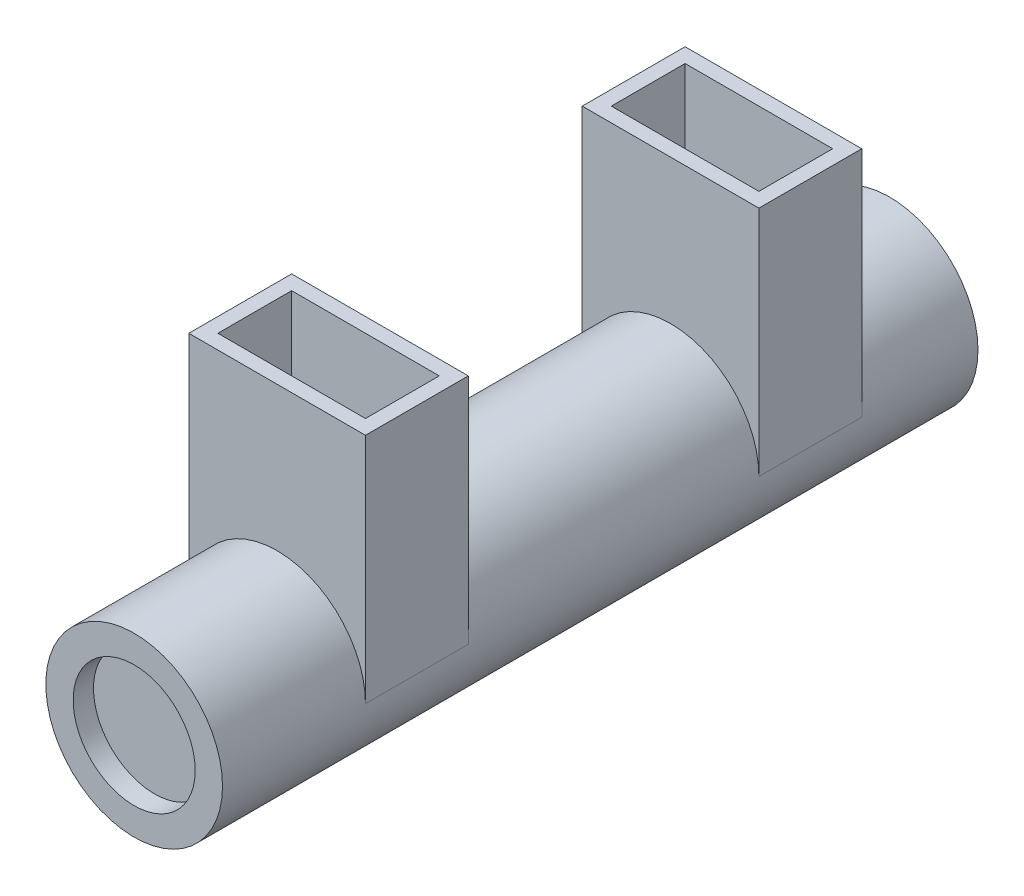
from build123d import *

# Parameters (mm, degrees)
SKETCH1_R           = 30.4
BOSS_EXTRUDE1_DEPTH = 260
SKETCH2_W           = 60.8
SKETCH2_H           = 35.4
BOSS_EXTRUDE2_DEPTH = 80
SKETCH3_W           = 50.8
SKETCH3_H           = 25.4
CUT_EXTRUDE1_DEPTH  = 80
CUT_EXTRUDE2_DEPTH  = 40
SKETCH5_R           = 21
CUT_EXTRUDE3_DEPTH  = 7


with BuildPart() as part:
    # Sketch1 → Boss-Extrude1 (new body)
    with BuildSketch(Plane.XY):
        Circle(SKETCH1_R)
    extrude(amount=BOSS_EXTRUDE1_DEPTH)

    # Sketch2 → Boss-Extrude2 (add)
    with BuildSketch(Plane(origin=(0, 0, 0), x_dir=(1, 0, 0), z_dir=(0, 1, 0))):
        with Locations((0, -57.7)):
            Rectangle(SKETCH2_W, SKETCH2_H)
    boss_extrude2 = extrude(amount=BOSS_EXTRUDE2_DEPTH)

    # Sketch3 → Cut-Extrude1 (cut)
    with BuildSketch(Plane(origin=(0, 80, 0), x_dir=(1, 0, 0), z_dir=(0, 1, 0))):
        with Locations((0, -57.7)):
            Rectangle(SKETCH3_W, SKETCH3_H)
    cut_extrude1 = extrude(amount=-CUT_EXTRUDE1_DEPTH, mode=Mode.SUBTRACT)

    # Mirror2: Boss-Extrude2, Cut-Extrude1 across plane
    add(boss_extrude2.mirror(Plane.XY.offset(125.4)))
    add(cut_extrude1.mirror(Plane.XY.offset(125.4)), mode=Mode.SUBTRACT)

    # Sketch4 → Cut-Extrude2 (cut)
    with BuildSketch(Plane(origin=(0, 0, 0), x_dir=(-1, 0, 0), z_dir=(0, 0, -1))):
        with BuildLine():
            Line((-3, 9.539392014), (-3, 13))
            Line((-3, 13), (3, 13))
            Line((3, 13), (3, 9.539392014))
            ThreePointArc((3, 9.539392014), (0, -10), (-3, 9.539392014))
        make_face()
    extrude(amount=-CUT_EXTRUDE2_DEPTH, mode=Mode.SUBTRACT)

    # Sketch5 → Cut-Extrude3 (cut)
    with BuildSketch(Plane.XY.offset(260)):
        Circle(SKETCH5_R)
    extrude(amount=-CUT_EXTRUDE3_DEPTH, mode=Mode.SUBTRACT)


solid = part.part
